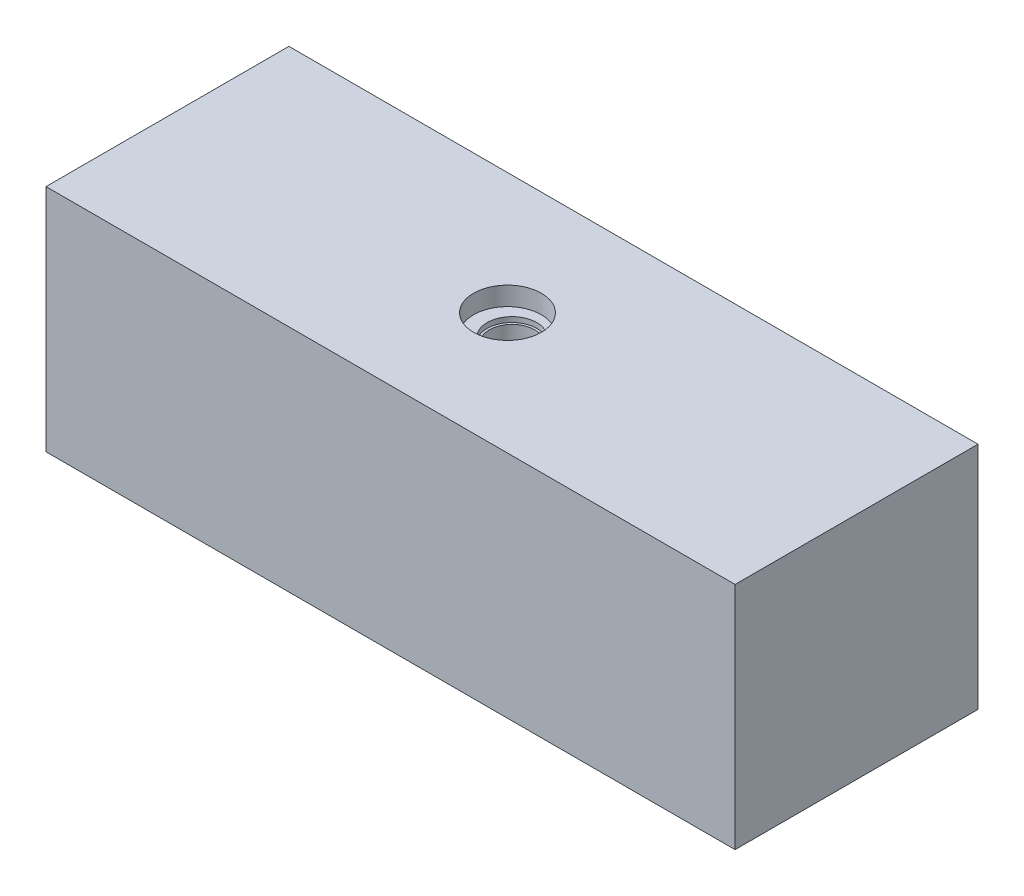
from build123d import *

# Parameters (mm, degrees)
SKETCH1_W           = 152.4
SKETCH1_H           = 53.721
BOSS_EXTRUDE1_DEPTH = 50.8
SKETCH2_R           = 5
CUT_EXTRUDE1_DEPTH  = 19.416667
SKETCH2_4_R         = 5.5
SKETCH2_4_R_2       = 5
CUT_EXTRUDE2_DEPTH  = 5.254167
SKETCH2_5_R         = 7.5
SKETCH2_5_R_2       = 5.5
CUT_EXTRUDE3_DEPTH  = 4.123106


with BuildPart() as part:
    # Sketch1 → Boss-Extrude1 (new body)
    with BuildSketch(Plane(origin=(0, 0, 0), x_dir=(1, 0, 0), z_dir=(0, 1, 0))):
        Rectangle(SKETCH1_W, SKETCH1_H)
    extrude(amount=BOSS_EXTRUDE1_DEPTH)

    # Sketch2 → Cut-Extrude1 (cut)
    with BuildSketch(Plane(origin=(0, 50.8, 0), x_dir=(1, 0, 0), z_dir=(0, 1, 0))):
        Circle(SKETCH2_R)
    extrude(amount=-CUT_EXTRUDE1_DEPTH, mode=Mode.SUBTRACT)

    # Sketch2<4> → Cut-Extrude2 (cut)
    with BuildSketch(Plane(origin=(0, 50.8, 0), x_dir=(1, 0, 0), z_dir=(0, 1, 0))):
        Circle(SKETCH2_4_R)
        Circle(SKETCH2_4_R_2, mode=Mode.SUBTRACT)
    extrude(amount=-CUT_EXTRUDE2_DEPTH, mode=Mode.SUBTRACT)

    # Sketch2<5> → Cut-Extrude3 (cut)
    with BuildSketch(Plane(origin=(0, 50.8, 0), x_dir=(1, 0, 0), z_dir=(0, 1, 0))):
        with Locations((-1, 0)):
            Circle(SKETCH2_5_R)
        Circle(SKETCH2_5_R_2, mode=Mode.SUBTRACT)
    extrude(amount=-CUT_EXTRUDE3_DEPTH, mode=Mode.SUBTRACT)


solid = part.part
